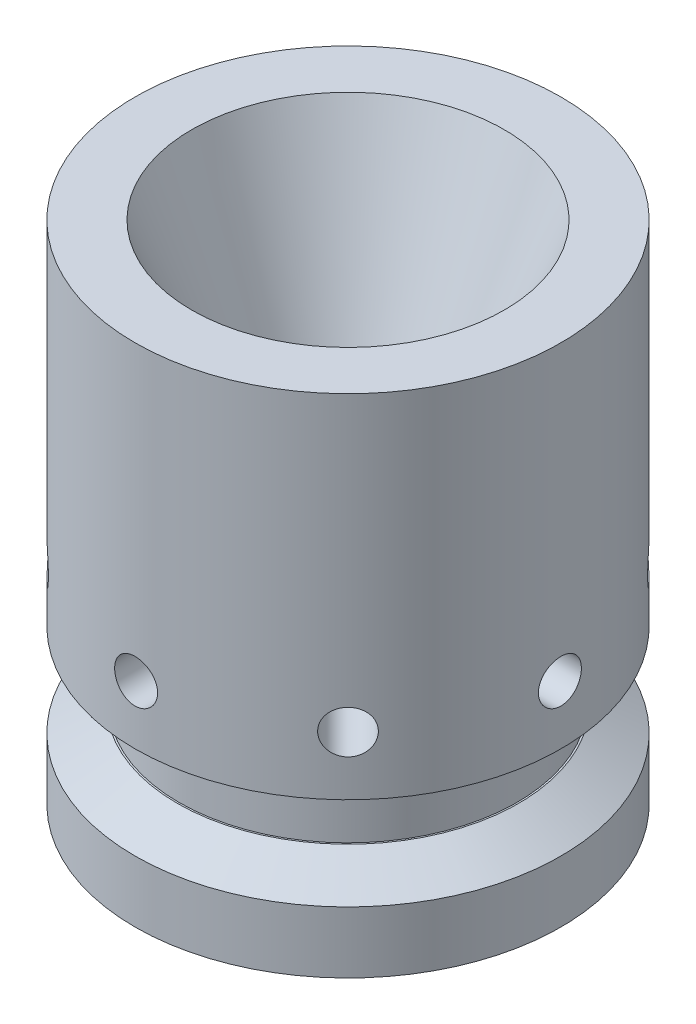
from build123d import *

# Parameters (mm, degrees)
SKETCH3_R          = 1.1
CUT_EXTRUDE1_DEPTH = 6
CIRPATTERN1_COUNT  = 8
CHAMFER2_SIZE      = 1.25
CHAMFER2_SIZE2     = 2.165063509


with BuildPart() as part:
    # Sketch2 → Revolve1 (revolve)
    with BuildSketch(Plane.XY):
        Polygon((-2, 0), (-2, 2), (-8, 17), (-10.9, 17), (-10.9, 2), (-10.9, -1), (-8.65, -1), (-8.65, -4.5), (-10.9, -4.5), (-10.9, -8.9), align=None)
    revolve(axis=Axis((0, 19.141519074, 0), (0, -1, 0)))

    # Sketch3 → Cut-Extrude1 (cut)
    with BuildSketch(Plane.ZY.offset(10.9)):
        with Locations((0, 2)):
            Circle(SKETCH3_R)
    cut_extrude1 = extrude(amount=-CUT_EXTRUDE1_DEPTH, mode=Mode.SUBTRACT)

    # CirPattern1: Cut-Extrude1 ×8 about axis
    cirpattern1_axis = Axis((0, 0, 0), (0, 1, 0))
    for i in range(1, CIRPATTERN1_COUNT):
        add(cut_extrude1.rotate(cirpattern1_axis, i * 360 / CIRPATTERN1_COUNT), mode=Mode.SUBTRACT)

    # Chamfer2
    chamfer2_edges = [part.edges().sort_by_distance(p)[0] for p in [
        (10.9, -4.5, 0),
    ]]
    chamfer2_side = [part.faces().sort_by_distance(p)[0] for p in [
        (10.9, -6.7, 0),
    ]]
    chamfer(chamfer2_edges, length=CHAMFER2_SIZE, length2=CHAMFER2_SIZE2, reference=chamfer2_side[0])


solid = part.part
